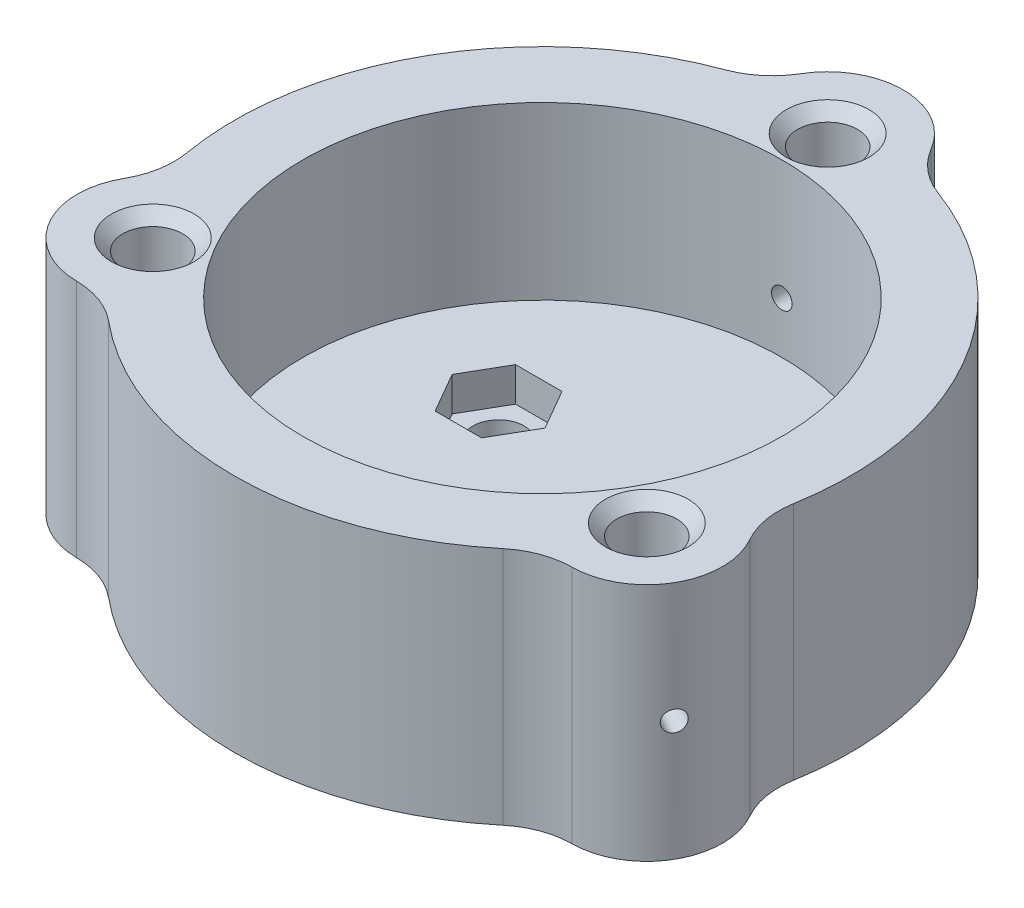
from build123d import *

# Parameters (mm, degrees)
SKETCH_1_R               = 2.625
SKETCH_1_R_2             = 21
EXTRUDE_1_DEPTH          = 15
EXTRUDE_START            = 6
EXTRUDE_2_DEPTH          = 6
FILLET_1_R               = 7
CHAMFER_1_SIZE           = 1
SKETCH_3_R               = 2.25
CUT_EXTRUDE_1_DEPTH      = 48.335527685
CUT_EXTRUDE_2_DEPTH      = 3
CUT_EXTRUDE_3_REACH      = 68.794
CUT_EXTRUDE_3_END_RADIUS = 21
SKETCH_5_R               = 0.9
PATTERN_CIRCULAR_1_COUNT = 3


with BuildPart() as part:
    # Эскиз1 → Бобышка-Вытянуть1 (new body)
    with BuildSketch(Plane(origin=(0, 0, 0), x_dir=(1, 0, 0), z_dir=(0, 1, 0))):
        with BuildLine():
            ThreePointArc((25.949265582, -7.458928593), (23.382685902, 13.5), (6.515011145, 26.2021875))
            ThreePointArc((6.515011145, 26.2021875), (0, 31.625), (-6.515011145, 26.2021875))
            ThreePointArc((-6.515011145, 26.2021875), (-23.382685902, 13.5), (-25.949265582, -7.458928593))
            ThreePointArc((-25.949265582, -7.458928593), (-27.388053395, -15.8125), (-19.434254437, -18.743258907))
            ThreePointArc((-19.434254437, -18.743258907), (0, -27), (19.434254437, -18.743258907))
            ThreePointArc((19.434254437, -18.743258907), (27.388053395, -15.8125), (25.949265582, -7.458928593))
        make_face()
        with Locations(Location((0, 25, 0), (0, 0, 270))):
            Circle(SKETCH_1_R, mode=Mode.SUBTRACT)
        with Locations(Location((0, 0, 0), (0, 0, 270))):
            Circle(SKETCH_1_R_2, mode=Mode.SUBTRACT)
        with Locations(Location((-21.650635095, -12.5, 0), (0, 0, 270))):
            Circle(SKETCH_1_R, mode=Mode.SUBTRACT)
        with Locations(Location((21.650635095, -12.5, 0), (0, 0, 270))):
            Circle(SKETCH_1_R, mode=Mode.SUBTRACT)
    extrude(amount=EXTRUDE_1_DEPTH)

    # Эскиз2 → Бобышка-Вытянуть2 (add)
    with BuildSketch(Plane.XZ.offset(EXTRUDE_START)):
        with BuildLine():
            ThreePointArc((25.949265582, 7.458928593), (27.388053395, 15.8125), (19.434254437, 18.743258907))
            ThreePointArc((19.434254437, 18.743258907), (0, 27), (-19.434254437, 18.743258907))
            ThreePointArc((-19.434254437, 18.743258907), (-27.388053395, 15.8125), (-25.949265582, 7.458928593))
            ThreePointArc((-25.949265582, 7.458928593), (-23.382685902, -13.5), (-6.515011145, -26.2021875))
            ThreePointArc((-6.515011145, -26.2021875), (0, -31.625), (6.515011145, -26.2021875))
            ThreePointArc((6.515011145, -26.2021875), (23.382685902, -13.5), (25.949265582, 7.458928593))
        make_face()
    extrude(amount=-EXTRUDE_2_DEPTH)

    # Скругление1
    fillet_1_edges = [part.edges().sort_by_distance(p)[0] for p in [
        (19.434254437, 4.5, 18.743258907),
        (-19.434254437, 4.5, 18.743258907),
        (-25.949265582, 4.5, 7.458928593),
        (-6.515011145, 4.5, -26.2021875),
        (6.515011145, 4.5, -26.2021875),
        (25.949265582, 4.5, 7.458928593),
    ]]
    fillet(fillet_1_edges, radius=FILLET_1_R)

    # Фаска1
    chamfer_1_edges = [part.edges().sort_by_distance(p)[0] for p in [
        (21.650635095, 15, 9.875),
        (0, 15, -27.625),
        (-21.650635095, 15, 9.875),
    ]]
    chamfer(chamfer_1_edges, length=CHAMFER_1_SIZE)

    # Эскиз3 → Вырез-Вытянуть1 (cut, through all)
    with BuildSketch(Plane.XZ.offset(6)):
        with Locations(Location((0, 10.5, 0), (0, 0, 270))):
            Circle(SKETCH_3_R)
        with Locations(Location((9.09326674, -5.25, 0), (0, 0, 270))):
            Circle(SKETCH_3_R)
        with Locations(Location((-9.09326674, -5.25, 0), (0, 0, 270))):
            Circle(SKETCH_3_R)
    extrude(amount=-CUT_EXTRUDE_1_DEPTH, mode=Mode.SUBTRACT)

    # Эскиз4 → Вырез-Вытянуть2 (cut)
    with BuildSketch(Plane(origin=(0, 0, 0), x_dir=(1, 0, 0), z_dir=(0, 1, 0))):
        Polygon((-4.070319398, -10.5), (-2.035159699, -14.025), (2.035159699, -14.025), (4.070319398, -10.5), (2.035159699, -6.975), (-2.035159699, -6.975), align=None)
        Polygon((11.128426439, 1.725), (13.163586138, 5.25), (11.128426439, 8.775), (7.058107041, 8.775), (5.022947342, 5.25), (7.058107041, 1.725), align=None)
        Polygon((-7.058107041, 8.775), (-11.128426439, 8.775), (-13.163586138, 5.25), (-11.128426439, 1.725), (-7.058107041, 1.725), (-5.022947342, 5.25), align=None)
    extrude(amount=-CUT_EXTRUDE_2_DEPTH, mode=Mode.SUBTRACT)

    # Вырез-Вытянуть3: up to this cylinder (the profile starts outside it)
    cut_extrude_3_end = Plane(origin=(0, 4.5, 0), z_dir=(0, -1, 0)) * Cylinder(CUT_EXTRUDE_3_END_RADIUS, 180.588, mode=Mode.PRIVATE)
    # Эскиз5 → Вырез-Вытянуть3 (cut, up to the surface)
    with BuildSketch(Plane(origin=(0, 0, -31.625), x_dir=(-1, 0, 0), z_dir=(0, 0, -1)), mode=Mode.PRIVATE) as cut_extrude_3_sk1:
        with Locations((0, 4.5)):
            Circle(SKETCH_5_R)
    cut_extrude_3_tool1 = extrude(cut_extrude_3_sk1.sketch, amount=-CUT_EXTRUDE_3_REACH, mode=Mode.PRIVATE) - cut_extrude_3_end
    cut_extrude_3 = cut_extrude_3_tool1.solids().sort_by_distance((0, 4.5, -31.625))[0]
    add(cut_extrude_3, mode=Mode.SUBTRACT)

    # Круговой массив1: Вырез-Вытянуть3 ×3 about axis
    pattern_circular_1_axis = Axis((0, 15, 0), (0, -1, 0))
    for i in range(1, PATTERN_CIRCULAR_1_COUNT):
        add(cut_extrude_3.rotate(pattern_circular_1_axis, i * 360 / PATTERN_CIRCULAR_1_COUNT), mode=Mode.SUBTRACT)


solid = part.part
